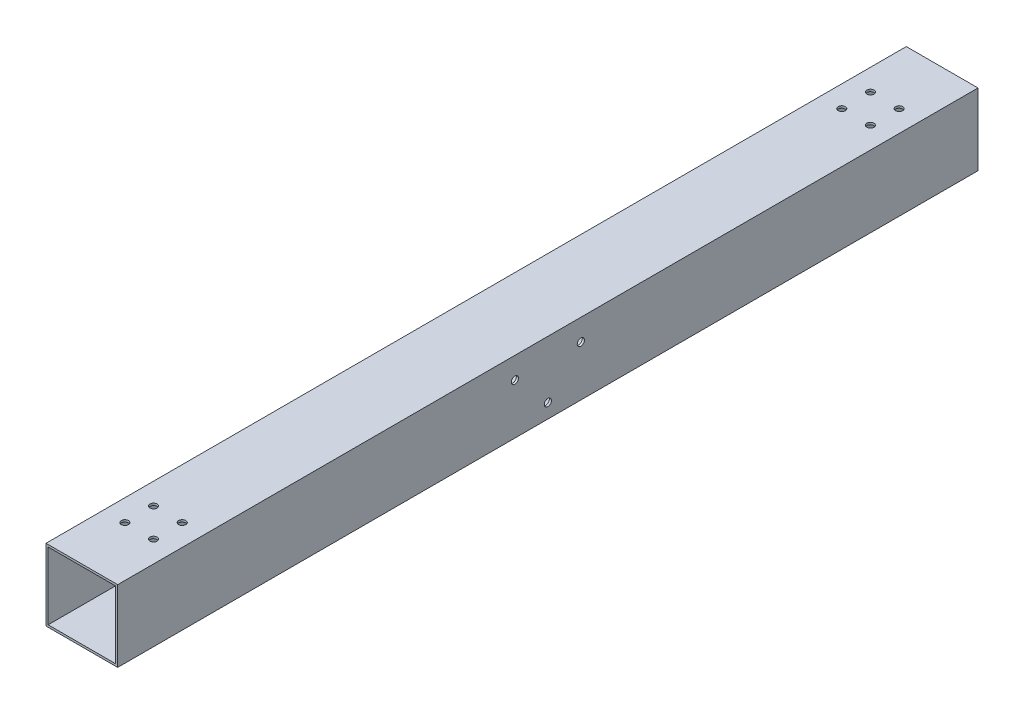
from build123d import *

# Parameters (mm, degrees)
SKETCH1_W           = 50
SKETCH1_H           = 50
SKETCH1_W_2         = 47
SKETCH1_H_2         = 47
BOSS_EXTRUDE1_DEPTH = 600
SKETCH2_R           = 2.5
CUT_EXTRUDE1_DEPTH  = 59
SKETCH3_R           = 2.5
CUT_EXTRUDE2_DEPTH  = 603.59853966


with BuildPart() as part:
    # Sketch1 → Boss-Extrude1 (new body)
    with BuildSketch(Plane.XY):
        Rectangle(SKETCH1_W, SKETCH1_H)
        Rectangle(SKETCH1_W_2, SKETCH1_H_2, mode=Mode.SUBTRACT)
    extrude(amount=BOSS_EXTRUDE1_DEPTH)

    # Sketch2 → Cut-Extrude1 (cut)
    with BuildSketch(Plane(origin=(25, 0, 0), x_dir=(0, 0, -1), z_dir=(1, 0, 0))):
        with Locations(Location((-300, -15, 0), (0, 0, 90))):
            Circle(SKETCH2_R)
        with Locations(Location((-277, 10, 0), (0, 0, 90))):
            Circle(SKETCH2_R)
        with Locations(Location((-323, 10, 0), (0, 0, 90))):
            Circle(SKETCH2_R)
    extrude(amount=-CUT_EXTRUDE1_DEPTH, mode=Mode.SUBTRACT)

    # Sketch3 → Cut-Extrude2 (cut, through all)
    with BuildSketch(Plane(origin=(0, 25, 0), x_dir=(1, 0, 0), z_dir=(0, 1, 0))):
        with Locations(Location((-10, -40, 0), (0, 0, 270))):
            Circle(SKETCH3_R)
        with Locations(Location((10, -40, 0), (0, 0, 270))):
            Circle(SKETCH3_R)
        with Locations(Location((-10, -60, 0), (0, 0, 270))):
            Circle(SKETCH3_R)
        with Locations(Location((10, -60, 0), (0, 0, 270))):
            Circle(SKETCH3_R)
        with Locations(Location((10, -540, 0), (0, 0, 270))):
            Circle(SKETCH3_R)
        with Locations(Location((-10, -540, 0), (0, 0, 270))):
            Circle(SKETCH3_R)
        with Locations(Location((10, -560, 0), (0, 0, 270))):
            Circle(SKETCH3_R)
        with Locations(Location((-10, -560, 0), (0, 0, 270))):
            Circle(SKETCH3_R)
    extrude(amount=-CUT_EXTRUDE2_DEPTH, mode=Mode.SUBTRACT)


solid = part.part
